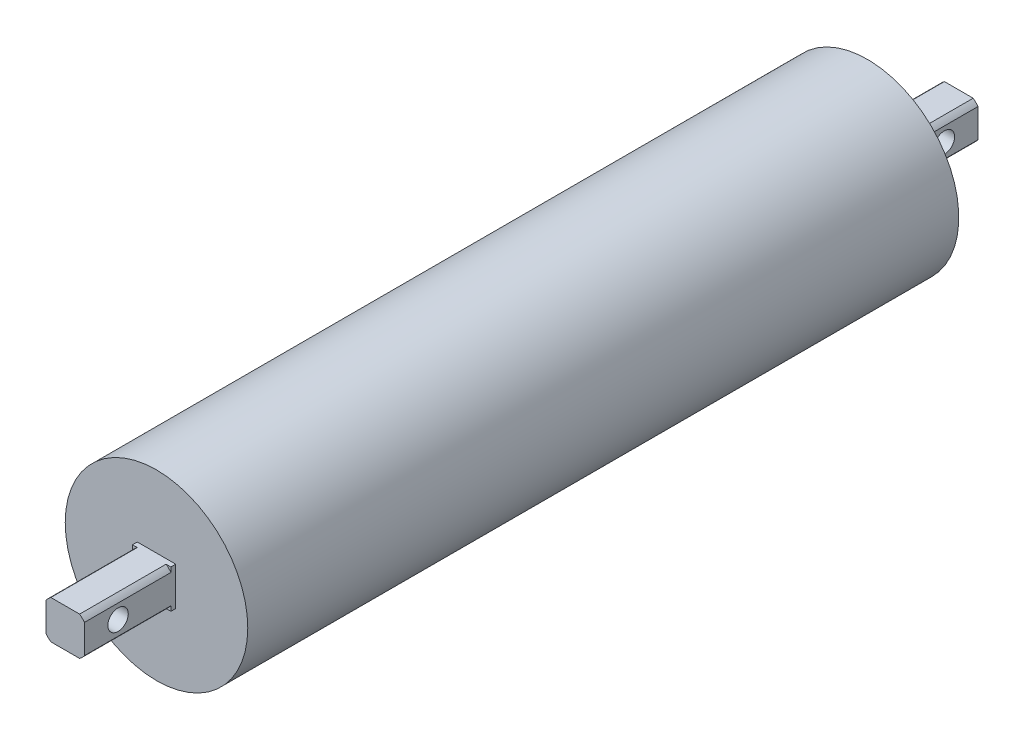
from build123d import *

# Parameters (mm, degrees)
SKETCH_1_R           = 38
EXTRUDE_1_DEPTH      = 150
SKETCH_2_R           = 10
EXTRUDE_2_DEPTH      = 36
SKETCH_3_OUTSIDE_W   = 148.554
SKETCH_3_OUTSIDE_H   = 148.554
SKETCH_3_OUTSIDE_W_2 = 16
SKETCH_3_OUTSIDE_H_2 = 16
CUT_EXTRUDE_1_DEPTH  = 38
HOLE_WIZARD_M10_1_D  = 8.5


with BuildPart() as part:
    # 草图1 → 凸台-拉伸1 (new, symmetric)
    with BuildSketch(Plane.XY):
        Circle(SKETCH_1_R)
    extrude(amount=EXTRUDE_1_DEPTH, both=True)

    # 草图2 → 凸台-拉伸2 (add)
    with BuildSketch(Plane.XY.offset(150)):
        Circle(SKETCH_2_R)
    extrude_2 = extrude(amount=EXTRUDE_2_DEPTH)

    # 草图3 outside → 切除-拉伸1 (cut)
    with BuildSketch(Plane.XY.offset(186)):
        Rectangle(SKETCH_3_OUTSIDE_W, SKETCH_3_OUTSIDE_H)
        Rectangle(SKETCH_3_OUTSIDE_W_2, SKETCH_3_OUTSIDE_H_2, mode=Mode.SUBTRACT)
    cut_extrude_1 = extrude(amount=-CUT_EXTRUDE_1_DEPTH, mode=Mode.SUBTRACT)

    # M10 螺纹孔1 (through all)
    with Locations(Plane.ZY.offset(8)):
        with Locations((172, 0)):
            hole_wizard_m10_1 = Hole(HOLE_WIZARD_M10_1_D / 2)

    # 镜向1: 凸台-拉伸2, 切除-拉伸1, M10 螺纹孔1 across plane
    add(extrude_2.mirror(Plane.XY))
    add(cut_extrude_1.mirror(Plane.XY), mode=Mode.SUBTRACT)
    add(hole_wizard_m10_1.mirror(Plane.XY), mode=Mode.SUBTRACT)


solid = part.part
